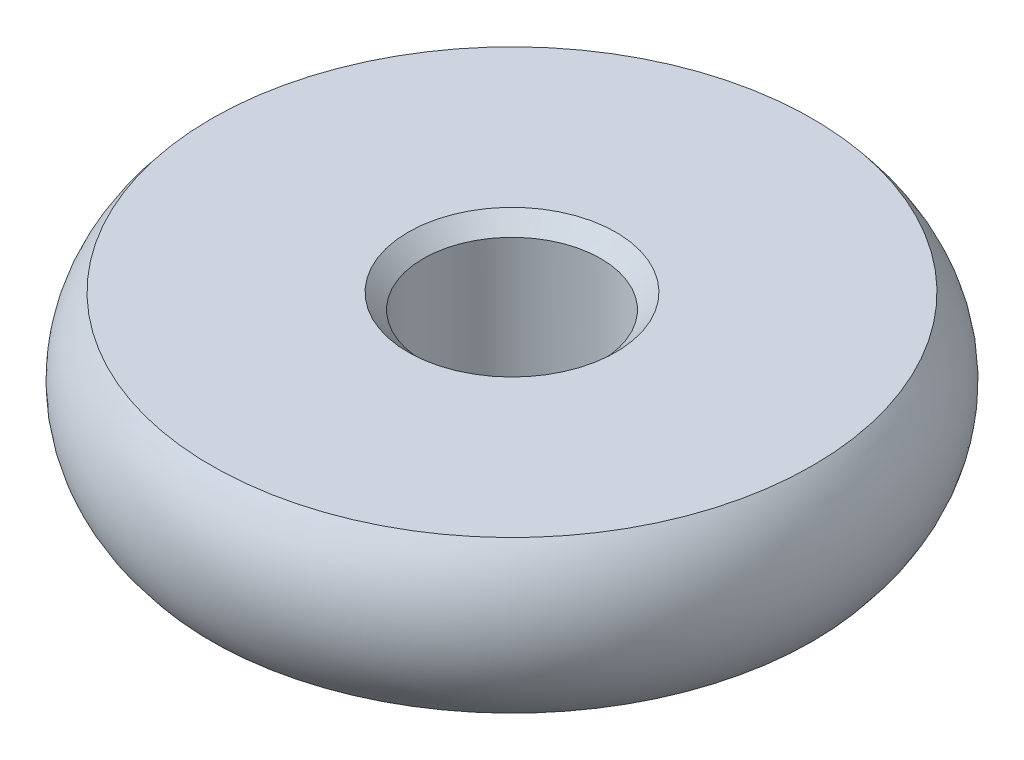
from build123d import *

# Parameters (mm, degrees)
CHAMFER1_SIZE = 3


with BuildPart() as part:
    # Sketch1 → Revolve1 (revolve)
    with BuildSketch(Plane.XY):
        with BuildLine():
            Line((17.5, 15), (59.270509831, 15))
            ThreePointArc((59.270509831, 15), (65, 0), (59.270509831, -15))
            Line((59.270509831, -15), (17.5, -15))
            Line((17.5, -15), (17.5, 15))
        make_face()
    revolve(axis=Axis((0, -1000, 0), (0, 1, 0)))

    # Chamfer1
    chamfer1_edges = [part.edges().sort_by_distance(p)[0] for p in [
        (-17.5, 15, 0),
        (-17.5, -15, 0),
    ]]
    chamfer(chamfer1_edges, length=CHAMFER1_SIZE)


solid = part.part
